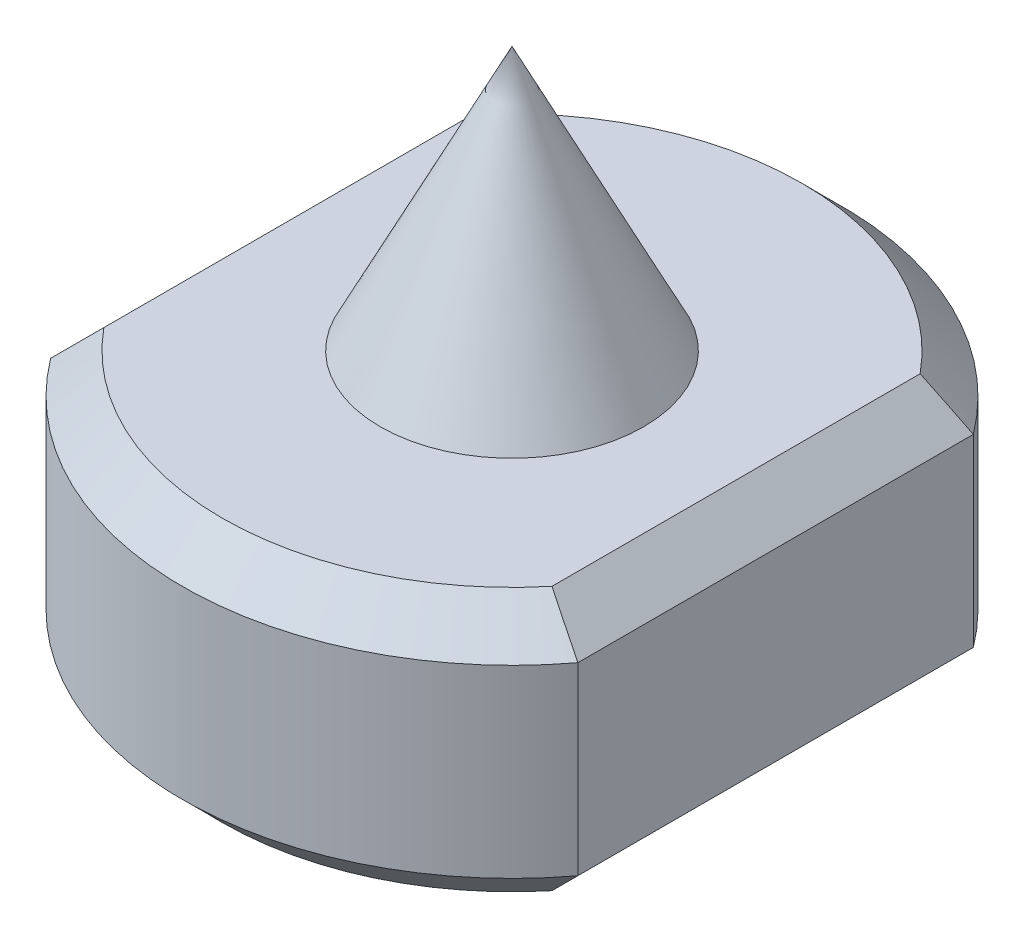
from build123d import *

# Parameters (mm, degrees)
SKETCH1_R           = 12.5
BOSS_EXTRUDE2_DEPTH = 10
CUT_EXTRUDE1_REACH  = 28.693
CHAMFER1_SIZE       = 1.5


with BuildPart() as part:
    # Sketch1 → Boss-Extrude2 (new body)
    with BuildSketch(Plane(origin=(0, 0, 0), x_dir=(1, 0, 0), z_dir=(0, 1, 0))):
        with Locations(Location((0, 0, 0), (0, 0, 270))):
            Circle(SKETCH1_R)
    extrude(amount=BOSS_EXTRUDE2_DEPTH)

    # Sketch2 → Revolve1 (revolve)
    with BuildSketch(Plane.XY):
        Polygon((5, 10), (0, 20), (0, 10), align=None)
    revolve(axis=Axis((0, -1000, 0), (0, 1, 0)))

    # Sketch3 → Cut-Extrude1 (cut, up to next)
    with BuildSketch(Plane(origin=(0, 0, 0), x_dir=(1, 0, 0), z_dir=(0, 1, 0)), mode=Mode.PRIVATE) as cut_extrude1_sk1:
        with BuildLine():
            Line((-10, 7.5), (-10, -7.5))
            ThreePointArc((-10, -7.5), (-12.5, 0), (-10, 7.5))
        make_face()
    cut_extrude1_tool1 = extrude(cut_extrude1_sk1.sketch, amount=CUT_EXTRUDE1_REACH, mode=Mode.PRIVATE) & part.part
    # Sketch3 → Cut-Extrude1 (cut, up to next)
    with BuildSketch(Plane(origin=(0, 0, 0), x_dir=(1, 0, 0), z_dir=(0, 1, 0)), mode=Mode.PRIVATE) as cut_extrude1_sk2:
        with BuildLine():
            Line((10, 7.5), (10, -7.5))
            ThreePointArc((10, -7.5), (12.5, 0), (10, 7.5))
        make_face()
    cut_extrude1_tool2 = extrude(cut_extrude1_sk2.sketch, amount=CUT_EXTRUDE1_REACH, mode=Mode.PRIVATE) & part.part
    add(cut_extrude1_tool1.solids().sort_by_distance((-11.0091, 0, 0))[0], mode=Mode.SUBTRACT)
    add(cut_extrude1_tool2.solids().sort_by_distance((11.0091, 0, 0))[0], mode=Mode.SUBTRACT)

    # Chamfer1
    chamfer1_edges = [part.edges().sort_by_distance(p)[0] for p in [
        (0, 10, -12.5),
        (0, 10, 12.5),
        (-10, 0, 0),
        (-10, 10, 0),
        (10, 0, 0),
        (10, 10, 0),
        (0, 0, -12.5),
        (0, 0, 12.5),
    ]]
    chamfer(chamfer1_edges, length=CHAMFER1_SIZE)


solid = part.part
